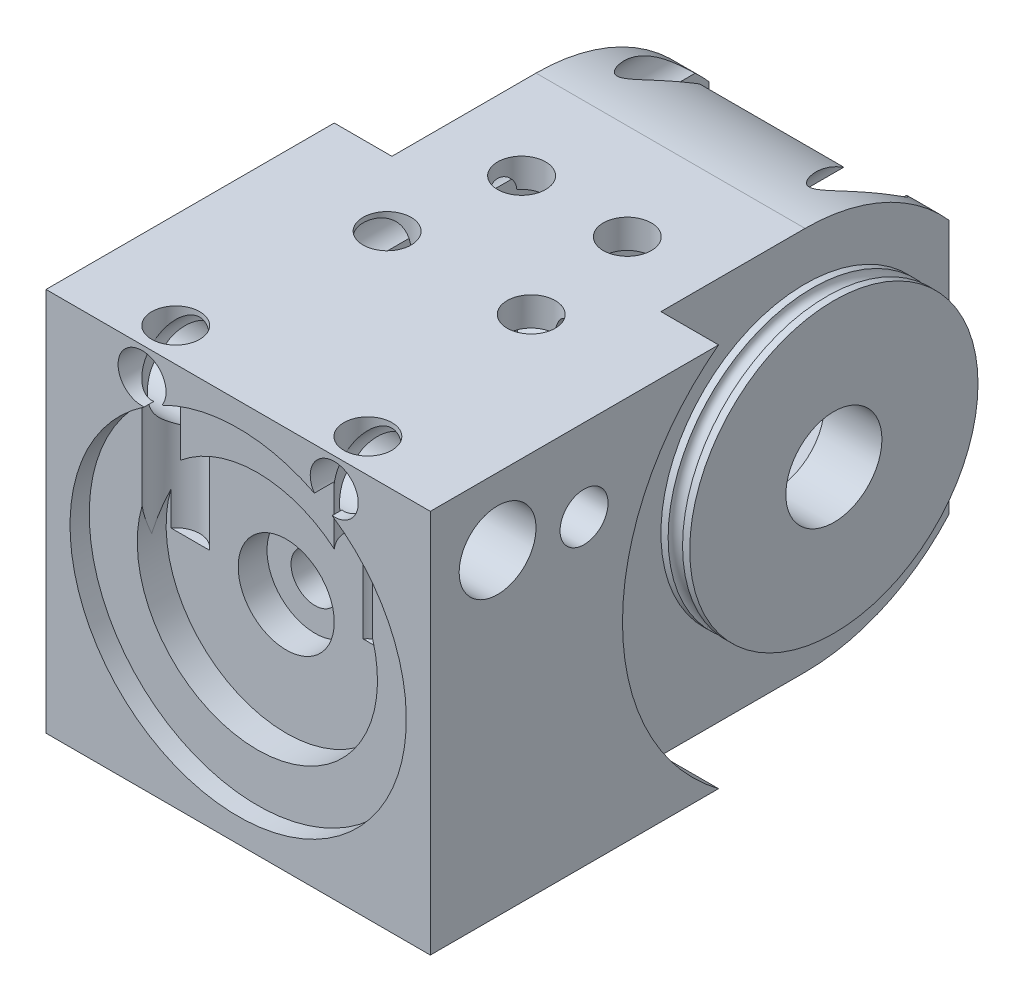
from build123d import *
from build123d.topology import SkipClean

# Parameters (mm, degrees)
CROQUIS1_W              = 40
CROQUIS1_H              = 40
SALIENTE_EXTRUIR1_DEPTH = 60
CROQUIS2_R              = 17.5
CORTAR_EXTRUIR1_DEPTH   = 2
CROQUIS3_R              = 12.5
CORTAR_EXTRUIR2_DEPTH   = 3
CROQUIS4_R              = 5
CORTAR_EXTRUIR3_DEPTH   = 3
CROQUIS5_R              = 2.5
CORTAR_EXTRUIR4_DEPTH   = 60.194594348
CORTAR_EXTRUIR5_DEPTH   = 6
CROQUIS7_R              = 15
SALIENTE_EXTRUIR2_DEPTH = 3
CORTAR_EXTRUIR6_START   = -6
CORTAR_EXTRUIR6_DEPTH   = 6
SALIENTE_EXTRUIR3_START = 3
CROQUIS10_R             = 15
SALIENTE_EXTRUIR3_DEPTH = 3
CORTAR_EXTRUIR7_DEPTH   = 72.805292284
CROQUIS13_R             = 5
CORTAR_EXTRUIR8_DEPTH   = 74.273460407
CROQUIS14_R             = 0.75
CROQUIS15_W             = 22
CROQUIS15_H             = 27.228756555
CORTAR_EXTRUIR9_DEPTH   = 40
CROQUIS16_R             = 4
CORTAR_EXTRUIR10_DEPTH  = 75.833147735
CROQUIS17_R             = 2.5
CORTAR_EXTRUIR11_DEPTH  = 20
CROQUIS19_R             = 2.5
CORTAR_EXTRUIR13_DEPTH  = 67.332495958
CROQUIS20_R             = 2.5
CORTAR_EXTRUIR14_DEPTH  = 75.833147842
CROQUIS21_R             = 2.5
CORTAR_EXTRUIR19_DEPTH  = 75.833147896
CROQUIS22_R             = 2.5
CORTAR_EXTRUIR20_DEPTH  = 75.833147842


with BuildPart() as part:
    # Croquis1 → Saliente-Extruir1 (new body)
    with BuildSketch(Plane.XY):
        Rectangle(CROQUIS1_W, CROQUIS1_H)
    extrude(amount=-SALIENTE_EXTRUIR1_DEPTH)

    # Croquis2 → Cortar-Extruir1 (cut)
    with BuildSketch(Plane.XY):
        Circle(CROQUIS2_R)
    extrude(amount=-CORTAR_EXTRUIR1_DEPTH, mode=Mode.SUBTRACT)

    # Croquis3 → Cortar-Extruir2 (cut)
    with BuildSketch(Plane.XY.offset(-2)):
        Circle(CROQUIS3_R)
    extrude(amount=-CORTAR_EXTRUIR2_DEPTH, mode=Mode.SUBTRACT)

    # Croquis4 → Cortar-Extruir3 (cut)
    with BuildSketch(Plane.XY.offset(-5)):
        Circle(CROQUIS4_R)
    extrude(amount=-CORTAR_EXTRUIR3_DEPTH, mode=Mode.SUBTRACT)

    # Croquis5 → Cortar-Extruir4 (cut, through all)
    with BuildSketch(Plane.XY.offset(-8)):
        Circle(CROQUIS5_R)
    extrude(amount=-CORTAR_EXTRUIR4_DEPTH, mode=Mode.SUBTRACT)

    # Croquis6 → Cortar-Extruir5 (cut)
    with BuildSketch(Plane(origin=(20, 0, 0), x_dir=(0, 0, -1), z_dir=(1, 0, 0))):
        with BuildLine():
            Line((30, 20), (60, 20))
            Line((60, 20), (60, -20))
            Line((60, -20), (30, -20))
            ThreePointArc((30, -20), (20, 0), (30, 20))
        make_face()
    extrude(amount=-CORTAR_EXTRUIR5_DEPTH, mode=Mode.SUBTRACT)

    # Croquis7 → Saliente-Extruir2 (add)
    with BuildSketch(Plane(origin=(14, 0, 0), x_dir=(0, 0, -1), z_dir=(1, 0, 0))):
        with Locations((45, 0)):
            Circle(CROQUIS7_R)
    extrude(amount=SALIENTE_EXTRUIR2_DEPTH)

    # Croquis9 → Cortar-Extruir6 (cut)
    with BuildSketch(Plane.ZY.offset(20).offset(CORTAR_EXTRUIR6_START)):
        with BuildLine():
            Line((-30, 20), (-60, 20))
            Line((-60, 20), (-60, -20))
            Line((-60, -20), (-30, -20))
            ThreePointArc((-30, -20), (-20, 0), (-30, 20))
        make_face()
    extrude(amount=CORTAR_EXTRUIR6_DEPTH, mode=Mode.SUBTRACT)

    # Croquis10 → Saliente-Extruir3 (add)
    with BuildSketch(Plane.ZY.offset(14).offset(SALIENTE_EXTRUIR3_START)):
        with Locations(Location((-45, 0, 0), (0, 0, 180))):
            Circle(CROQUIS10_R)
    extrude(amount=-SALIENTE_EXTRUIR3_DEPTH)

    # Croquis12 → Cortar-Extruir7 (cut, through all)
    with BuildSketch(Plane(origin=(14, 0, 0), x_dir=(0, 0, -1), z_dir=(1, 0, 0))):
        with BuildLine():
            Line((45, 20), (60, 20))
            Line((60, 20), (60, 13.228756555))
            ThreePointArc((60, 13.228756555), (53.228756555, 18.228756555), (45, 20))
        make_face()
        with BuildLine():
            Line((45, -20), (60, -20))
            Line((60, -20), (60, -13.228756555))
            ThreePointArc((60, -13.228756555), (53.228756555, -18.228756555), (45, -20))
        make_face()
    extrude(amount=-CORTAR_EXTRUIR7_DEPTH, mode=Mode.SUBTRACT)

    # Croquis13 → Cortar-Extruir8 (cut, through all)
    with BuildSketch(Plane(origin=(17, 0, 0), x_dir=(0, 0, -1), z_dir=(1, 0, 0))):
        with Locations((45, 0)):
            Circle(CROQUIS13_R)
    extrude(amount=-CORTAR_EXTRUIR8_DEPTH, mode=Mode.SUBTRACT)

    # Croquis14 → Cortar-Revolución1 (revolve, cut)
    with BuildSketch(Plane.XY.offset(-45), mode=Mode.PRIVATE) as cortar_revoluci_n1_sk:
        with Locations((15.5, 15)):
            Circle(CROQUIS14_R)
        with Locations((-15.5, 15)):
            Circle(CROQUIS14_R)
    revolve(cortar_revoluci_n1_sk.sketch.rotate(Axis((-17, 0, -45), (1, 0, 0)), 270), axis=Axis((-17, 0, -45), (1, 0, 0)), mode=Mode.SUBTRACT)

    # Croquis15 → Cortar-Extruir9 (cut)
    with BuildSketch(Plane(origin=(0, 0, -60), x_dir=(-1, 0, 0), z_dir=(0, 0, -1))):
        with Locations((0, 3.385621722)):
            Rectangle(CROQUIS15_W, CROQUIS15_H)
    extrude(amount=-CORTAR_EXTRUIR9_DEPTH, mode=Mode.SUBTRACT)

    # Croquis16 → Cortar-Extruir10 (cut, through all)
    with BuildSketch(Plane.ZY.offset(20)):
        with Locations((-7, 13)):
            Circle(CROQUIS16_R)
    extrude(amount=-CORTAR_EXTRUIR10_DEPTH, mode=Mode.SUBTRACT)

    # Croquis17 → Cortar-Extruir11 (cut)
    with BuildSketch(Plane(origin=(0, 20, 0), x_dir=(1, 0, 0), z_dir=(0, 1, 0))):
        with Locations(Location((10, 3.5, 0), (0, 0, 270))):
            Circle(CROQUIS17_R)
        with Locations(Location((-10, 3.5, 0), (0, 0, 270))):
            Circle(CROQUIS17_R)
    extrude(amount=-CORTAR_EXTRUIR11_DEPTH, mode=Mode.SUBTRACT)

    # Croquis19 → Cortar-Extruir13 (cut, through all)
    with SkipClean():  # the faces are left unmerged after this step: merging them gives an invalid solid
        with BuildSketch(Plane(origin=(0, 0, -60), x_dir=(-1, 0, 0), z_dir=(0, 0, -1))):
            with Locations((-10, 17)):
                Circle(CROQUIS19_R)
            with Locations(Location((10, 17, 0), (0, 0, 180))):
                Circle(CROQUIS19_R)
        extrude(amount=-CORTAR_EXTRUIR13_DEPTH, mode=Mode.SUBTRACT)

    # Croquis20 → Cortar-Extruir14 (cut, through all)
    with SkipClean():  # the faces are left unmerged after this step: merging them gives an invalid solid
        with BuildSketch(Plane(origin=(0, 20, 0), x_dir=(1, 0, 0), z_dir=(0, 1, 0))):
            with Locations(Location((5.5, 35, 0), (0, 0, 270))):
                Circle(CROQUIS20_R)
            with Locations(Location((-5.5, 35, 0), (0, 0, 270))):
                Circle(CROQUIS20_R)
        extrude(amount=-CORTAR_EXTRUIR14_DEPTH, mode=Mode.SUBTRACT)

    # Croquis21 → Cortar-Extruir19 (cut, through all)
    with SkipClean():  # the faces are left unmerged after this step: merging them gives an invalid solid
        with BuildSketch(Plane(origin=(20, 0, 0), x_dir=(0, 0, -1), z_dir=(1, 0, 0))):
            with Locations((16, 11.5)):
                Circle(CROQUIS21_R)
        extrude(amount=-CORTAR_EXTRUIR19_DEPTH, mode=Mode.SUBTRACT)

    # Croquis22 → Cortar-Extruir20 (cut, through all)
    with SkipClean():  # the faces are left unmerged after this step: merging them gives an invalid solid
        with BuildSketch(Plane(origin=(0, 20, 0), x_dir=(1, 0, 0), z_dir=(0, 1, 0))):
            with Locations(Location((7.5, 23, 0), (0, 0, 270))):
                Circle(CROQUIS22_R)
            with Locations(Location((-7.5, 23, 0), (0, 0, 270))):
                Circle(CROQUIS22_R)
        extrude(amount=-CORTAR_EXTRUIR20_DEPTH, mode=Mode.SUBTRACT)


solid = part.part
